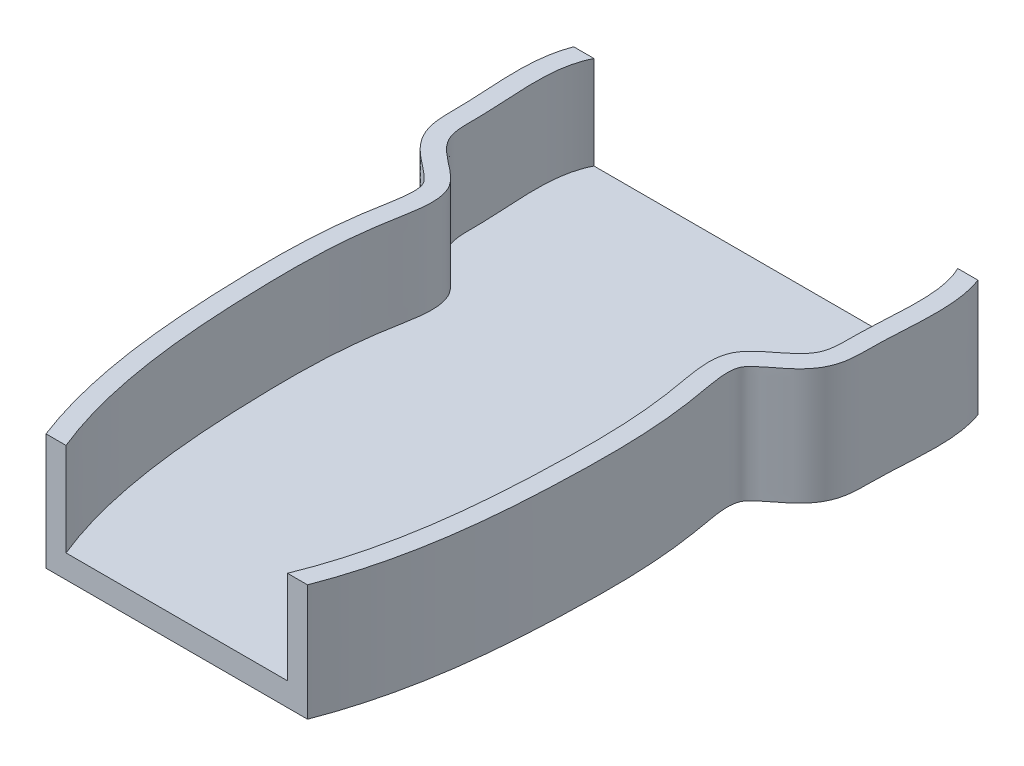
from build123d import *

# Parameters (mm, degrees)
BOSS_EXTRUDE1_DEPTH     = 12.7
BOSS_EXTRUDE2_DEPTH     = 3.175
CUT_EXTRUDE1_DEPTH      = 101.014238242
CUT_EXTRUDE1_DEPTH_BACK = 101.014238242
SKETCH4_W               = 67.36433317
SKETCH4_H               = 14.054429222
CUT_EXTRUDE2_DEPTH      = 101.014238242
CUT_EXTRUDE2_DEPTH_BACK = 101.014238242
SKETCH5_W               = 49.650139024
SKETCH5_H               = 11.35292813


with BuildPart() as part:
    # Sketch1 → Boss-Extrude1 (new body)
    with BuildSketch(Plane(origin=(0, 0, 0), x_dir=(1, 0, 0), z_dir=(0, 1, 0))):
        with BuildLine():
            Line((-21.5265, -3.2766), (0, -3.2766))
            Line((0, -3.2766), (0, -0.7366))
            Line((0, -0.7366), (-22.203368624, -0.7366))
            add(Edge.make_bspline(
                [(-14.766234965, -94.996), (-14.996668515, -94.550702961), (-15.450701659, -93.682415389), (-16.413439589, -91.767388196), (-17.887523694, -88.422224636), (-19.594560475, -83.469769024), (-21.052486613, -77.397632478), (-22.034096417, -71.250607736), (-22.635448462, -65.107414018), (-22.944039592, -59.024976794), (-23.084444297, -53.118128932), (-23.002154011, -48.13674982), (-22.683676725, -43.998708308), (-22.359989314, -41.340657214), (-22.007277512, -39.131677721), (-21.704921231, -37.500648633), (-21.469245926, -36.019201003), (-21.369830007, -34.730271156), (-21.446569087, -33.731143322), (-21.627659106, -33.187469417), (-21.810713281, -32.873112803), (-22.148038091, -32.44515636), (-22.867304718, -31.779192766), (-24.075169697, -30.851423932), (-25.449709236, -29.757875503), (-26.604671748, -28.583220413), (-27.409184219, -27.341372966), (-28.002750801, -25.901376523), (-28.25036248, -24.243876032), (-28.270193255, -22.474579202), (-28.2711543, -20.975677511), (-28.338741981, -19.393014324), (-28.42894001, -17.767125256), (-28.551990808, -15.552264072), (-28.639753679, -12.730710637), (-28.395723992, -9.330406242), (-27.628982584, -6.526282911), (-26.475505353, -4.408806497), (-25.501439175, -3.190317526), (-24.569763004, -2.309659584), (-23.92459958, -1.802530754), (-23.375440816, -1.427178175), (-23.011355495, -1.200536295), (-22.725705767, -1.036197531), (-22.502588374, -0.908307956), (-22.321180554, -0.804189707), (-22.203368624, -0.7366)],
                knots=[-0.006638515, -0.006638515, -0.006638515, -0.006638515, 0.009346854, 0.025332222, 0.057302959, 0.121244433, 0.185185906, 0.24912738, 0.313068853, 0.377010327, 0.4409518, 0.504893274, 0.536864011, 0.568834748, 0.584820116, 0.600805484, 0.616790853, 0.632776221, 0.648761589, 0.664746958, 0.672739642, 0.680732326, 0.696717695, 0.712703063, 0.728688431, 0.7446738, 0.752666484, 0.760659168, 0.776644537, 0.792629905, 0.808615273, 0.824600642, 0.84058601, 0.856571379, 0.888542115, 0.920512852, 0.952483589, 0.968468957, 0.984454326, 0.99244701, 1.000439694, 1.004436036, 1.008432378, 1.010430549, 1.01242872, 1.016425062, 1.016425062, 1.016425062, 1.016425062], degree=3))
            Line((-14.766234965, -94.996), (0, -94.996))
            Line((0, -94.996), (0, -92.456))
            Line((0, -92.456), (-13.2207, -92.456))
            add(Edge.make_bspline(
                [(-21.5265, -3.2766), (-27.673005337, -6.802902412), (-25.371163365, -16.369853549), (-25.935584149, -27.56197211), (-17.602342179, -30.7914771), (-20.487516457, -42.996088051), (-20.730621659, -62.486681847), (-18.952436581, -81.379811959), (-13.2207, -92.456)],
                knots=[0, 0, 0, 0, 0.208497884, 0.25519267, 0.340986981, 0.42476814, 0.602384632, 1, 1, 1, 1], degree=3))
        make_face()
    boss_extrude1 = extrude(amount=BOSS_EXTRUDE1_DEPTH)

    # Mirror1: Boss-Extrude1 across plane
    add(boss_extrude1.mirror(Plane(origin=(0, 0, 0), x_dir=(0, 0, 1), z_dir=(1, 0, 0))))

    # Sketch3 → Boss-Extrude2 (add)
    with BuildSketch(Plane(origin=(0, 0, 0), x_dir=(1, 0, 0), z_dir=(0, 1, 0))):
        with BuildLine():
            Line((-14.766234965, -94.996), (14.766234965, -94.996))
            add(Edge.make_bspline(
                [(14.766234965, -94.996), (14.996668515, -94.550702961), (15.450701659, -93.682415389), (16.413439589, -91.767388196), (17.887523694, -88.422224636), (19.594560475, -83.469769024), (21.052486613, -77.397632478), (22.034096417, -71.250607736), (22.635448462, -65.107414018), (22.944039592, -59.024976794), (23.084444297, -53.118128932), (23.002154011, -48.13674982), (22.683676725, -43.998708308), (22.359989314, -41.340657214), (22.007277512, -39.131677721), (21.704921231, -37.500648633), (21.469245926, -36.019201003), (21.369830007, -34.730271156), (21.446569087, -33.731143322), (21.627659106, -33.187469417), (21.810713281, -32.873112803), (22.148038091, -32.44515636), (22.867304718, -31.779192766), (24.075169697, -30.851423932), (25.449709236, -29.757875503), (26.604671748, -28.583220413), (27.409184219, -27.341372966), (28.002750801, -25.901376523), (28.25036248, -24.243876032), (28.270193255, -22.474579202), (28.2711543, -20.975677511), (28.338741981, -19.393014324), (28.42894001, -17.767125256), (28.551990808, -15.552264072), (28.639753679, -12.730710637), (28.395723992, -9.330406242), (27.628982584, -6.526282911), (26.475505353, -4.408806497), (25.501439175, -3.190317526), (24.569763004, -2.309659584), (23.92459958, -1.802530754), (23.375440816, -1.427178175), (23.011355495, -1.200536295), (22.725705767, -1.036197531), (22.502588374, -0.908307956), (22.321180554, -0.804189707), (22.203368624, -0.7366)],
                knots=[-0.006638515, -0.006638515, -0.006638515, -0.006638515, 0.009346854, 0.025332222, 0.057302959, 0.121244433, 0.185185906, 0.24912738, 0.313068853, 0.377010327, 0.4409518, 0.504893274, 0.536864011, 0.568834748, 0.584820116, 0.600805484, 0.616790853, 0.632776221, 0.648761589, 0.664746958, 0.672739642, 0.680732326, 0.696717695, 0.712703063, 0.728688431, 0.7446738, 0.752666484, 0.760659168, 0.776644537, 0.792629905, 0.808615273, 0.824600642, 0.84058601, 0.856571379, 0.888542115, 0.920512852, 0.952483589, 0.968468957, 0.984454326, 0.99244701, 1.000439694, 1.004436036, 1.008432378, 1.010430549, 1.01242872, 1.016425062, 1.016425062, 1.016425062, 1.016425062], degree=3))
            Line((22.203368624, -0.7366), (-22.203368624, -0.7366))
            add(Edge.make_bspline(
                [(-22.203368624, -0.7366), (-22.321180554, -0.804189707), (-22.502588374, -0.908307956), (-22.725705767, -1.036197531), (-23.011355495, -1.200536295), (-23.375440816, -1.427178175), (-23.92459958, -1.802530754), (-24.569763004, -2.309659584), (-25.501439175, -3.190317526), (-26.475505353, -4.408806497), (-27.628982584, -6.526282911), (-28.395723992, -9.330406242), (-28.639753679, -12.730710637), (-28.551990808, -15.552264072), (-28.42894001, -17.767125256), (-28.338741981, -19.393014324), (-28.2711543, -20.975677511), (-28.270193255, -22.474579202), (-28.25036248, -24.243876032), (-28.002750801, -25.901376523), (-27.409184219, -27.341372966), (-26.604671748, -28.583220413), (-25.449709236, -29.757875503), (-24.075169697, -30.851423932), (-22.867304718, -31.779192766), (-22.148038091, -32.44515636), (-21.810713281, -32.873112803), (-21.627659106, -33.187469417), (-21.446569087, -33.731143322), (-21.369830007, -34.730271156), (-21.469245926, -36.019201003), (-21.704921231, -37.500648633), (-22.007277512, -39.131677721), (-22.359989314, -41.340657214), (-22.683676725, -43.998708308), (-23.002154011, -48.13674982), (-23.084444297, -53.118128932), (-22.944039592, -59.024976794), (-22.635448462, -65.107414018), (-22.034096417, -71.250607736), (-21.052486613, -77.397632478), (-19.594560475, -83.469769024), (-17.887523694, -88.422224636), (-16.413439589, -91.767388196), (-15.450701659, -93.682415389), (-14.996668515, -94.550702961), (-14.766234965, -94.996)],
                knots=[-0.006638515, -0.006638515, -0.006638515, -0.006638515, -0.002642173, -0.000644001, 0.00135417, 0.005350512, 0.009346854, 0.017339538, 0.025332222, 0.041317591, 0.057302959, 0.089273696, 0.121244433, 0.153215169, 0.169200538, 0.185185906, 0.201171274, 0.217156643, 0.233142011, 0.24912738, 0.257120064, 0.265112748, 0.281098116, 0.297083485, 0.313068853, 0.329054222, 0.337046906, 0.34503959, 0.361024958, 0.377010327, 0.392995695, 0.408981064, 0.424966432, 0.4409518, 0.472922537, 0.504893274, 0.568834748, 0.632776221, 0.696717695, 0.760659168, 0.824600642, 0.888542115, 0.952483589, 0.984454326, 1.000439694, 1.016425062, 1.016425062, 1.016425062, 1.016425062], degree=3))
        make_face()
    extrude(amount=-BOSS_EXTRUDE2_DEPTH)

    # Sketch4 → Cut-Extrude1 (cut, two sides: drawn at the far end of the back side and taken through both)
    with BuildSketch(Plane(origin=(0, 0, 0), x_dir=(1, 0, 0), z_dir=(0, 1, 0)).offset(-CUT_EXTRUDE1_DEPTH_BACK)):
        with Locations((-0.681036793, 0.354931298)):
            Rectangle(SKETCH4_W, SKETCH4_H)
    extrude(amount=CUT_EXTRUDE1_DEPTH + CUT_EXTRUDE1_DEPTH_BACK, mode=Mode.SUBTRACT)

    # Sketch5 → Cut-Extrude2 (cut, two sides: drawn at the far end of the back side and taken through both)
    with BuildSketch(Plane(origin=(0, 0, 0), x_dir=(1, 0, 0), z_dir=(0, 1, 0)).offset(-CUT_EXTRUDE2_DEPTH_BACK)):
        with Locations((-1.165062558, -94.05095474)):
            Rectangle(SKETCH5_W, SKETCH5_H)
    extrude(amount=CUT_EXTRUDE2_DEPTH + CUT_EXTRUDE2_DEPTH_BACK, mode=Mode.SUBTRACT)


solid = part.part
